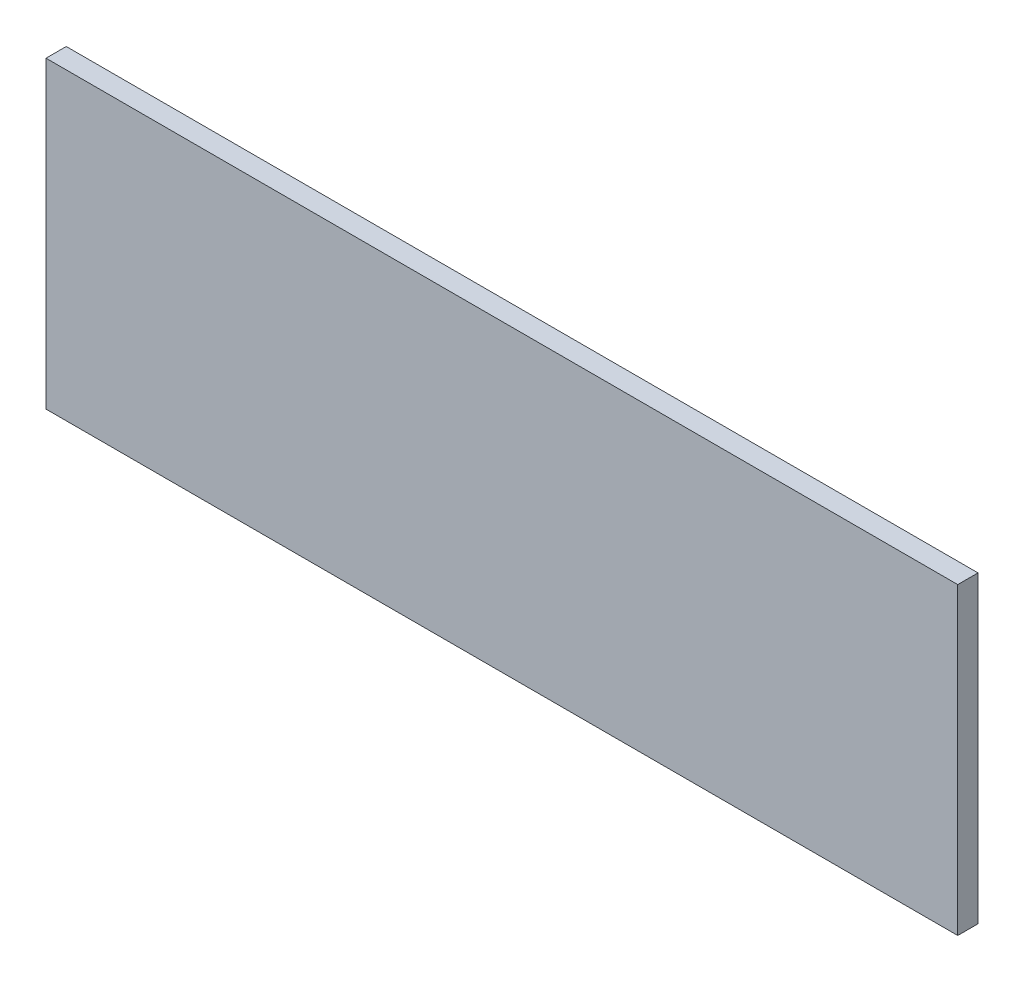
from build123d import *

# Parameters (mm, degrees)
SKETCH_1_W      = 90
SKETCH_1_H      = 2
EXTRUDE_1_DEPTH = 30


with BuildPart() as part:
    # Эскиз1 → Бобышка-Вытянуть1 (new body)
    with BuildSketch(Plane(origin=(0, 0, 0), x_dir=(1, 0, 0), z_dir=(0, 1, 0))):
        Rectangle(SKETCH_1_W, SKETCH_1_H)
    extrude(amount=EXTRUDE_1_DEPTH)


solid = part.part
